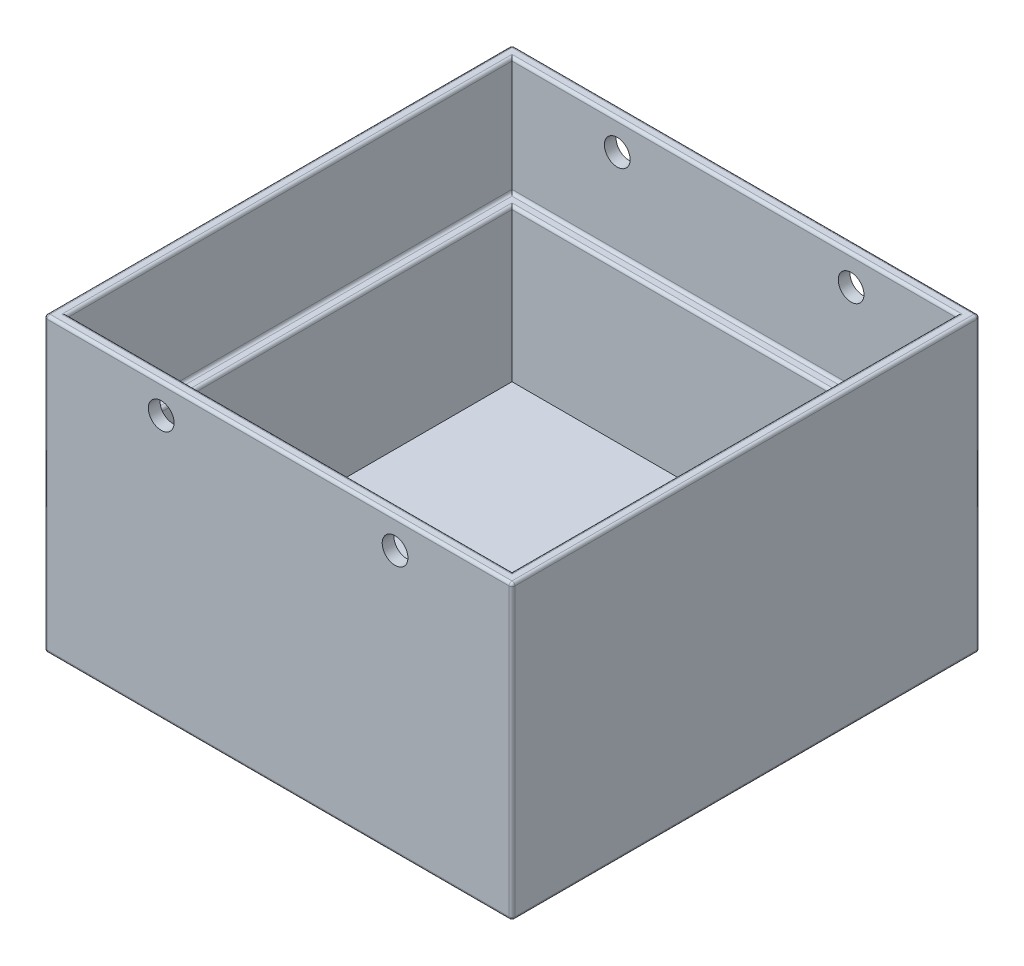
from build123d import *

# Parameters (mm, degrees)
SKETCH1_W           = 80
SKETCH1_H           = 50
BOSS_EXTRUDE1_DEPTH = 80
SHELL1_T            = -4
SKETCH2_W           = 76
SKETCH2_H           = 76
SKETCH2_W_2         = 72
SKETCH2_H_2         = 72
CUT_EXTRUDE1_DEPTH  = 20
SKETCH3_R           = 2.2
CUT_EXTRUDE2_DEPTH  = 124.693168769
FILLET1_R           = 0.5


with BuildPart() as part:
    # Sketch1 → Boss-Extrude1 (new body)
    with BuildSketch(Plane.XY):
        with Locations((40, 25)):
            Rectangle(SKETCH1_W, SKETCH1_H)
    extrude(amount=BOSS_EXTRUDE1_DEPTH)

    # Shell1
    shell1_openings = [part.faces().sort_by_distance(p)[0] for p in [
        (40, 50, 40),
    ]]
    offset(amount=SHELL1_T, openings=shell1_openings, kind=Kind.INTERSECTION)

    # Sketch2 → Cut-Extrude1 (cut)
    with BuildSketch(Plane(origin=(0, 50, 0), x_dir=(1, 0, 0), z_dir=(0, 1, 0))):
        with Locations((40, -40)):
            Rectangle(SKETCH2_W, SKETCH2_H)
        with Locations((40, -40)):
            Rectangle(SKETCH2_W_2, SKETCH2_H_2, mode=Mode.SUBTRACT)
    extrude(amount=-CUT_EXTRUDE1_DEPTH, mode=Mode.SUBTRACT)

    # Sketch3 → Cut-Extrude2 (cut, through all)
    with BuildSketch(Plane.XY.offset(80)):
        with Locations((20, 45)):
            Circle(SKETCH3_R)
        with Locations((60, 45)):
            Circle(SKETCH3_R)
    extrude(amount=-CUT_EXTRUDE2_DEPTH, mode=Mode.SUBTRACT)

    # Fillet1
    fillet1_edges = [part.edges().sort_by_distance(p)[0] for p in [
        (80, 25, 80),
        (40, 50, 80),
        (4, 30, 40),
        (40, 30, 76),
        (76, 30, 40),
        (40, 50, 2),
        (78, 50, 40),
        (40, 30, 78),
        (2, 30, 40),
        (40, 30, 4),
        (40, 30, 2),
        (78, 30, 40),
        (2, 50, 40),
        (40, 50, 78),
        (0, 25, 80),
        (40, 50, 0),
        (80, 25, 0),
        (40, 0, 0),
        (0, 25, 0),
        (0, 50, 40),
        (80, 50, 40),
        (80, 0, 40),
        (0, 0, 40),
        (40, 0, 80),
    ]]
    fillet(fillet1_edges, radius=FILLET1_R)


solid = part.part
